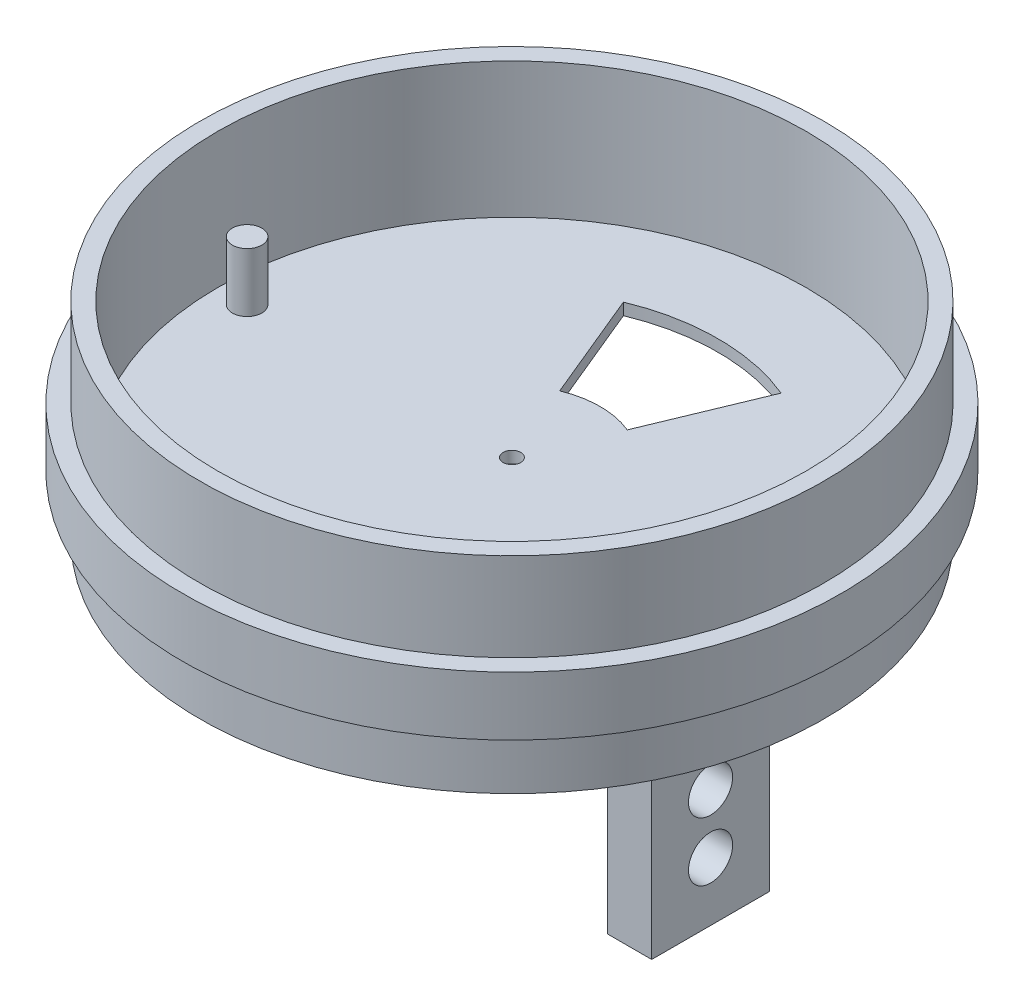
from build123d import *

# Parameters (mm, degrees)
SKETCH5_R               = 2.5
BOSS_EXTRUDE2_DEPTH     = 10
CIRPATTERN2_COUNT       = 2
CUT_EXTRUDE4_REACH      = 84.468
SKETCH7_R               = 1.5
CUT_EXTRUDE5_DEPTH      = 83.46817568
SKETCH10_W              = 7.5
SKETCH10_H              = 20
BOSS_EXTRUDE3_DEPTH     = 50
CUT_EXTRUDE6_REACH      = 113.36
SKETCH11_R              = 3.75
LPATTERN1_COUNT         = 4
LPATTERN1_PITCH         = 10
MIRROR1_COPY_1_REACH    = 113.36
MIRROR1_COPY_1_SKETCH_R = 3.75
MIRROR1_COPY_2_REACH    = 113.36
MIRROR1_COPY_2_SKETCH_R = 3.75
MIRROR1_COPY_3_REACH    = 113.36
MIRROR1_COPY_3_SKETCH_R = 3.75
FILLET1_R               = 2.5


with BuildPart() as part:
    # Sketch4 → Revolve2 (revolve)
    with BuildSketch(Plane(origin=(0, 0, 0), x_dir=(0, 0, -1), z_dir=(1, 0, 0))):
        Polygon((0, 0), (50, 0), (50, -10), (53, -10), (53, 0), (56, 0), (56, 10), (53, 10), (53, 25), (50, 25), (50, 2), (0, 2), align=None)
    revolve(axis=Axis((0, 0, 0), (0, 1, 0)))

    # Sketch5 → Boss-Extrude2 (add)
    with BuildSketch(Plane(origin=(0, 2, 0), x_dir=(1, 0, 0), z_dir=(0, 1, 0))):
        with Locations(Location((-45, 0, 0), (0, 0, 270))):
            Circle(SKETCH5_R)
    boss_extrude2 = extrude(amount=BOSS_EXTRUDE2_DEPTH)

    # CirPattern2: Boss-Extrude2 ×2 about axis
    cirpattern2_axis = Axis((0.112781955, 0, 0), (0, 1, 0))
    for i in range(1, CIRPATTERN2_COUNT):
        add(boss_extrude2.rotate(cirpattern2_axis, i * 360 / CIRPATTERN2_COUNT))

    # Sketch6 → Cut-Extrude4 (cut, up to next)
    with BuildSketch(Plane(origin=(0, 2, 0), x_dir=(1, 0, 0), z_dir=(0, 1, 0)), mode=Mode.PRIVATE) as cut_extrude4_sk1:
        with BuildLine():
            Line((-5.740251485, 13.858192988), (-13.393920133, 32.335783638))
            ThreePointArc((-13.393920133, 32.335783638), (0, 35), (13.393920133, 32.335783638))
            Line((13.393920133, 32.335783638), (5.740251485, 13.858192988))
            ThreePointArc((5.740251485, 13.858192988), (0, 15), (-5.740251485, 13.858192988))
        make_face()
    cut_extrude4_tool1 = extrude(cut_extrude4_sk1.sketch, amount=-CUT_EXTRUDE4_REACH, mode=Mode.PRIVATE) & part.part
    add(cut_extrude4_tool1.solids().sort_by_distance((0, 2, -25.661711))[0], mode=Mode.SUBTRACT)

    # Sketch7 → Cut-Extrude5 (cut, through all)
    with BuildSketch(Plane(origin=(0, 2, 0), x_dir=(1, 0, 0), z_dir=(0, 1, 0))):
        with Locations(Location((0, 0, 0), (0, 0, 270))):
            Circle(SKETCH7_R)
    extrude(amount=-CUT_EXTRUDE5_DEPTH, mode=Mode.SUBTRACT)

    # Sketch10 → Boss-Extrude3 (add)
    with BuildSketch(Plane.XZ):
        with Locations((30, 0)):
            Rectangle(SKETCH10_W, SKETCH10_H)
    boss_extrude3 = extrude(amount=BOSS_EXTRUDE3_DEPTH)

    # Sketch11 → Cut-Extrude6 (cut, up to next)
    with BuildSketch(Plane.ZY.offset(-26.25), mode=Mode.PRIVATE) as cut_extrude6_sk1:
        with Locations((0, -10)):
            Circle(SKETCH11_R)
    cut_extrude6_tool1 = extrude(cut_extrude6_sk1.sketch, amount=-CUT_EXTRUDE6_REACH, mode=Mode.PRIVATE) & part.part
    cut_extrude6 = cut_extrude6_tool1.solids().sort_by_distance((26.25, -10, 0))[0]
    add(cut_extrude6, mode=Mode.SUBTRACT)

    # LPattern1: Cut-Extrude6 ×4
    with Locations(*[(0, -i * LPATTERN1_PITCH, 0) for i in range(1, LPATTERN1_COUNT)]):
        add(cut_extrude6, mode=Mode.SUBTRACT)

    # Mirror1: Boss-Extrude3, Cut-Extrude6 across plane
    add(boss_extrude3.mirror(Plane(origin=(0, 0, 0), x_dir=(0, 0, 1), z_dir=(1, 0, 0))))
    add(cut_extrude6.mirror(Plane(origin=(0, 0, 0), x_dir=(0, 0, 1), z_dir=(1, 0, 0))), mode=Mode.SUBTRACT)

    # Mirror1 copy 1 sketch → Mirror1 copy 1 (cut, up to next)
    with BuildSketch(Plane(origin=(-26.25, -10, 0), x_dir=(0, 0, 1), z_dir=(1, 0, 0)), mode=Mode.PRIVATE) as mirror1_copy_1_sk1:
        with Locations((0, 10)):
            Circle(MIRROR1_COPY_1_SKETCH_R)
    mirror1_copy_1_tool1 = extrude(mirror1_copy_1_sk1.sketch, amount=-MIRROR1_COPY_1_REACH, mode=Mode.PRIVATE) & part.part
    add(mirror1_copy_1_tool1.solids().sort_by_distance((-26.25, -20, 0))[0], mode=Mode.SUBTRACT)

    # Mirror1 copy 2 sketch → Mirror1 copy 2 (cut, up to next)
    with BuildSketch(Plane(origin=(-26.25, -20, 0), x_dir=(0, 0, 1), z_dir=(1, 0, 0)), mode=Mode.PRIVATE) as mirror1_copy_2_sk1:
        with Locations((0, 10)):
            Circle(MIRROR1_COPY_2_SKETCH_R)
    mirror1_copy_2_tool1 = extrude(mirror1_copy_2_sk1.sketch, amount=-MIRROR1_COPY_2_REACH, mode=Mode.PRIVATE) & part.part
    add(mirror1_copy_2_tool1.solids().sort_by_distance((-26.25, -30, 0))[0], mode=Mode.SUBTRACT)

    # Mirror1 copy 3 sketch → Mirror1 copy 3 (cut, up to next)
    with BuildSketch(Plane(origin=(-26.25, -30, 0), x_dir=(0, 0, 1), z_dir=(1, 0, 0)), mode=Mode.PRIVATE) as mirror1_copy_3_sk1:
        with Locations((0, 10)):
            Circle(MIRROR1_COPY_3_SKETCH_R)
    mirror1_copy_3_tool1 = extrude(mirror1_copy_3_sk1.sketch, amount=-MIRROR1_COPY_3_REACH, mode=Mode.PRIVATE) & part.part
    add(mirror1_copy_3_tool1.solids().sort_by_distance((-26.25, -40, 0))[0], mode=Mode.SUBTRACT)

    # Fillet1
    fillet1_edges = [part.edges().sort_by_distance(p)[0] for p in [
        (30, 0, -10),
        (26.25, 0, 0),
        (30, 0, 10),
        (33.75, 0, 0),
        (-30, 0, 10),
        (-33.75, 0, 0),
        (-30, 0, -10),
        (-26.25, 0, 0),
    ]]
    fillet(fillet1_edges, radius=FILLET1_R)


solid = part.part
